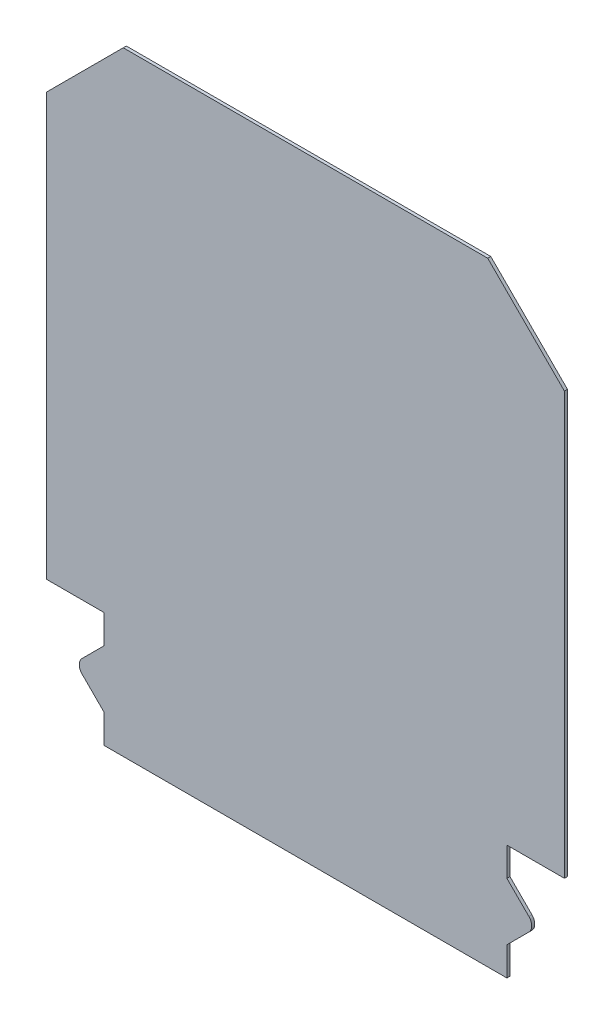
from build123d import *

# Parameters (mm, degrees)
SKETCH2_W           = 540
SKETCH2_H           = 640
BOSS_EXTRUDE1_DEPTH = 3.175
CUT_EXTRUDE1_DEPTH  = 838.382875765
FILLET1_R           = 10


with BuildPart() as part:
    # Sketch2 → Boss-Extrude1 (new body)
    with BuildSketch(Plane.XY):
        with Locations((270, 320)):
            Rectangle(SKETCH2_W, SKETCH2_H)
    extrude(amount=BOSS_EXTRUDE1_DEPTH)

    # Sketch3 → Cut-Extrude1 (cut, through all)
    with BuildSketch(Plane.XY.offset(3.175)):
        Polygon((0, 640), (0, 560), (80, 640), align=None)
        Polygon((540, 560), (460, 640), (540, 640), align=None)
        Polygon((0, 120), (60, 120), (60, 90), (30, 60), (60, 30), (60, 0), (0, 0), align=None)
        Polygon((540, 0), (540, 120), (480, 120), (480, 90), (510, 60), (480, 30), (480, 0), align=None)
    extrude(amount=-CUT_EXTRUDE1_DEPTH, mode=Mode.SUBTRACT)

    # Fillet1
    fillet1_edges = [part.edges().sort_by_distance(p)[0] for p in [
        (30, 60, 1.5875),
        (510, 60, 1.5875),
    ]]
    fillet(fillet1_edges, radius=FILLET1_R)


solid = part.part
